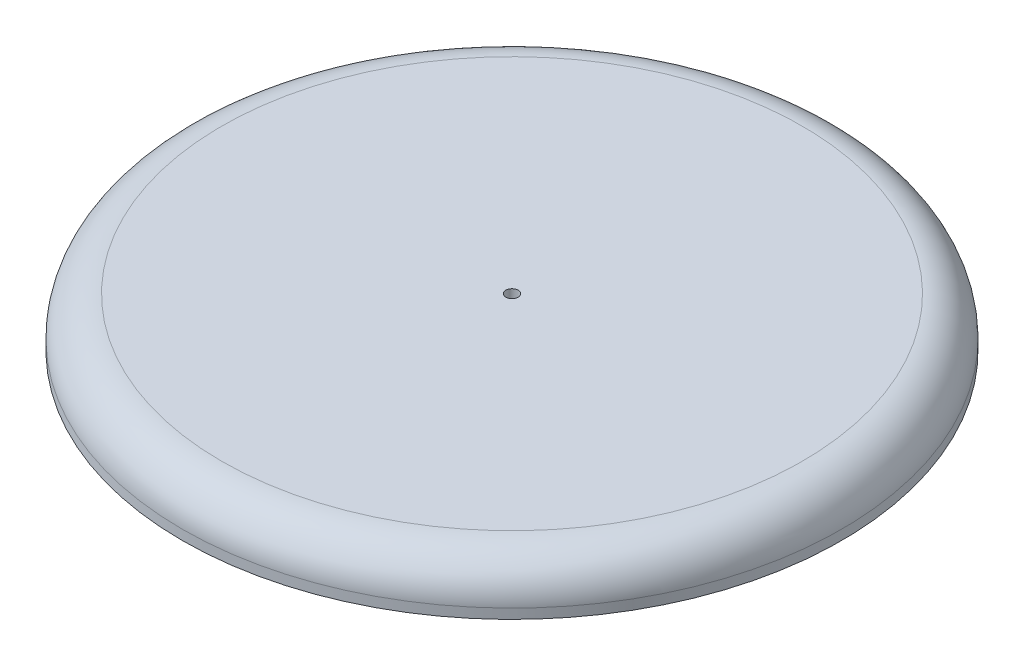
from build123d import *

# Parameters (mm, degrees)
SKETCH1_R           = 67.15
BOSS_EXTRUDE1_DEPTH = 10
FILLET1_R           = 8
CUT_EXTRUDE3_REACH  = 97.49
SKETCH4_R           = 1.25


with BuildPart() as part:
    # Sketch1 → Boss-Extrude1 (new body)
    with BuildSketch(Plane(origin=(0, 0, 0), x_dir=(1, 0, 0), z_dir=(0, 1, 0))):
        with Locations(Location((0, 0, 0), (0, 0, 270))):
            Circle(SKETCH1_R)
    extrude(amount=BOSS_EXTRUDE1_DEPTH)

    # Fillet1
    fillet1_edges = [part.edges().sort_by_distance(p)[0] for p in [
        (0, 10, -67.15),
    ]]
    fillet(fillet1_edges, radius=FILLET1_R)

    # Sketch4 → Cut-Extrude3 (cut, up to next)
    with BuildSketch(Plane(origin=(0, 10, 0), x_dir=(1, 0, 0), z_dir=(0, 1, 0)), mode=Mode.PRIVATE) as cut_extrude3_sk1:
        with Locations(Location((0, 0, 0), (0, 0, 270))):
            Circle(SKETCH4_R)
    cut_extrude3_tool1 = extrude(cut_extrude3_sk1.sketch, amount=-CUT_EXTRUDE3_REACH, mode=Mode.PRIVATE) & part.part
    add(cut_extrude3_tool1.solids().sort_by_distance((0, 10, 0))[0], mode=Mode.SUBTRACT)


solid = part.part
